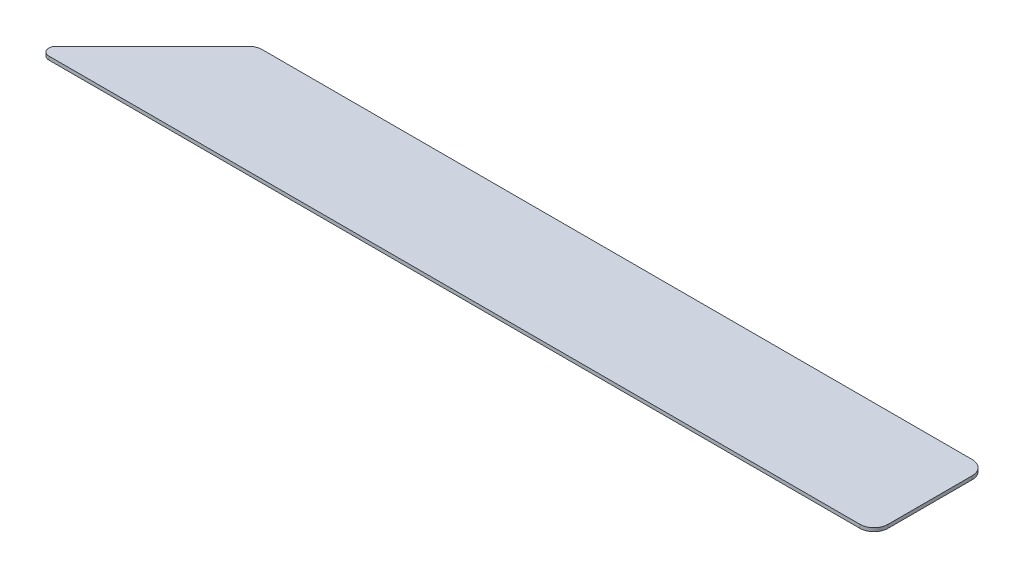
from build123d import *

# Parameters (mm, degrees)
BOSS_EXTRUDE1_DEPTH = 1.5875


with BuildPart() as part:
    # Sketch1 → Boss-Extrude1 (new body)
    with BuildSketch(Plane(origin=(0, 0, 0), x_dir=(1, 0, 0), z_dir=(0, 1, 0))):
        with BuildLine():
            Line((7.665128061, 0), (374.65, 0))
            ThreePointArc((374.65, 0), (379.140128061, 1.859871939), (381, 6.35))
            Line((381, 6.35), (381, 44.45))
            ThreePointArc((381, 44.45), (379.140128061, 48.940128061), (374.65, 50.8))
            Line((374.65, 50.8), (53.430256121, 50.8))
            ThreePointArc((53.430256121, 50.8), (51.000216326, 50.316635031), (48.940128061, 48.940128061))
            Line((48.940128061, 48.940128061), (5.42006403, 5.42006403))
            ThreePointArc((5.42006403, 5.42006403), (4.731810545, 1.959980102), (7.665128061, 0))
        make_face()
    extrude(amount=BOSS_EXTRUDE1_DEPTH)


solid = part.part
